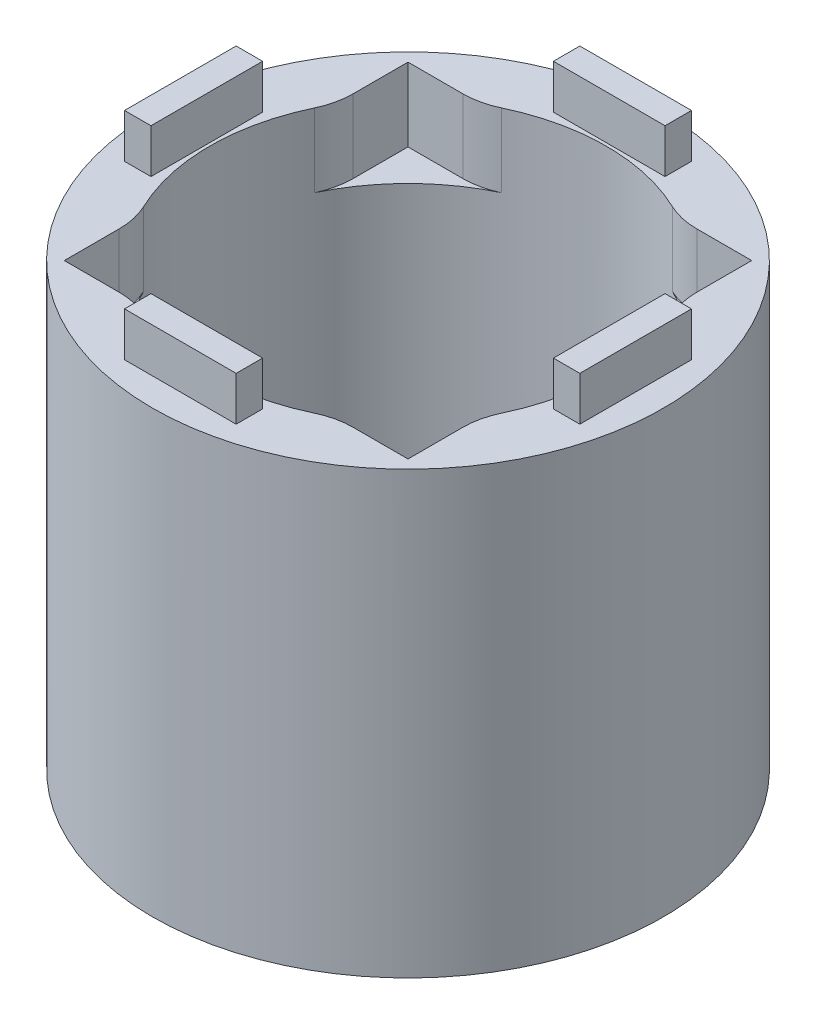
from build123d import *

# Parameters (mm, degrees)
SKETCH_1_R          = 17.4
EXTRUDE_1_DEPTH     = 30
SKETCH_2_R          = 13.5
CUT_EXTRUDE_1_DEPTH = 39.801030914
SKETCH_3_W          = 7.6
SKETCH_3_H          = 1.8
SKETCH_3_W_2        = 1.8
SKETCH_3_H_2        = 7.6
EXTRUDE_2_DEPTH     = 3
SKETCH_4_W          = 20
SKETCH_4_H          = 10
CUT_EXTRUDE_2_DEPTH = 42.164547854
FILLET_1_R          = 5
SKETCH_5_W          = 23.4
SKETCH_5_H          = 23.4
CUT_EXTRUDE_3_DEPTH = 5
FILLET_2_R          = 5


with BuildPart() as part:
    # 草图1 → 凸台-拉伸1 (new body)
    with BuildSketch(Plane(origin=(0, 0, 0), x_dir=(1, 0, 0), z_dir=(0, 1, 0))):
        with Locations(Location((0, 0, 0), (0, 0, 270))):
            Circle(SKETCH_1_R)
    extrude(amount=EXTRUDE_1_DEPTH)

    # 草图2 → 切除-拉伸1 (cut, through all)
    with BuildSketch(Plane(origin=(0, 30, 0), x_dir=(1, 0, 0), z_dir=(0, 1, 0))):
        with Locations(Location((0, 0, 0), (0, 0, 270))):
            Circle(SKETCH_2_R)
    extrude(amount=-CUT_EXTRUDE_1_DEPTH, mode=Mode.SUBTRACT)

    # 草图3 → 凸台-拉伸2 (add)
    with BuildSketch(Plane(origin=(0, 30, 0), x_dir=(1, 0, 0), z_dir=(0, 1, 0))):
        Polygon((13.7, 3.8), (13.7, 0), (13.7, -3.8), (15.5, -3.8), (15.5, 3.8), align=None)
        with Locations((0, -14.6)):
            Rectangle(SKETCH_3_W, SKETCH_3_H)
        with Locations((-14.6, 0)):
            Rectangle(SKETCH_3_W_2, SKETCH_3_H_2)
        with Locations((0, 14.6)):
            Rectangle(SKETCH_3_W, SKETCH_3_H)
    extrude(amount=EXTRUDE_2_DEPTH)

    # 草图4 → 切除-拉伸2 (cut, through all)
    with BuildSketch(Plane(origin=(0, 0, 0), x_dir=(0, 0, -1), z_dir=(1, 0, 0))):
        with Locations((0, 5)):
            Rectangle(SKETCH_4_W, SKETCH_4_H)
    extrude(amount=-CUT_EXTRUDE_2_DEPTH, mode=Mode.SUBTRACT)

    # 圆角1
    fillet_1_edges = [part.edges().sort_by_distance(p)[0] for p in [
        (-11.654280291, 10, -10),
        (-11.654280291, 10, 10),
    ]]
    fillet(fillet_1_edges, radius=FILLET_1_R)

    # 草图5 → 切除-拉伸3 (cut)
    with BuildSketch(Plane(origin=(0, 30, 0), x_dir=(1, 0, 0), z_dir=(0, 1, 0))):
        Rectangle(SKETCH_5_W, SKETCH_5_H)
    extrude(amount=-CUT_EXTRUDE_3_DEPTH, mode=Mode.SUBTRACT)

    # 圆角2
    fillet_2_edges = [part.edges().sort_by_distance(p)[0] for p in [
        (11.7, 27.5, -6.734983296),
        (11.7, 27.5, 6.734983296),
        (6.734983296, 27.5, 11.7),
        (-6.734983296, 27.5, 11.7),
        (-11.7, 27.5, 6.734983296),
        (-11.7, 27.5, -6.734983296),
        (-6.734983296, 27.5, -11.7),
        (6.734983296, 27.5, -11.7),
    ]]
    fillet(fillet_2_edges, radius=FILLET_2_R)


solid = part.part
